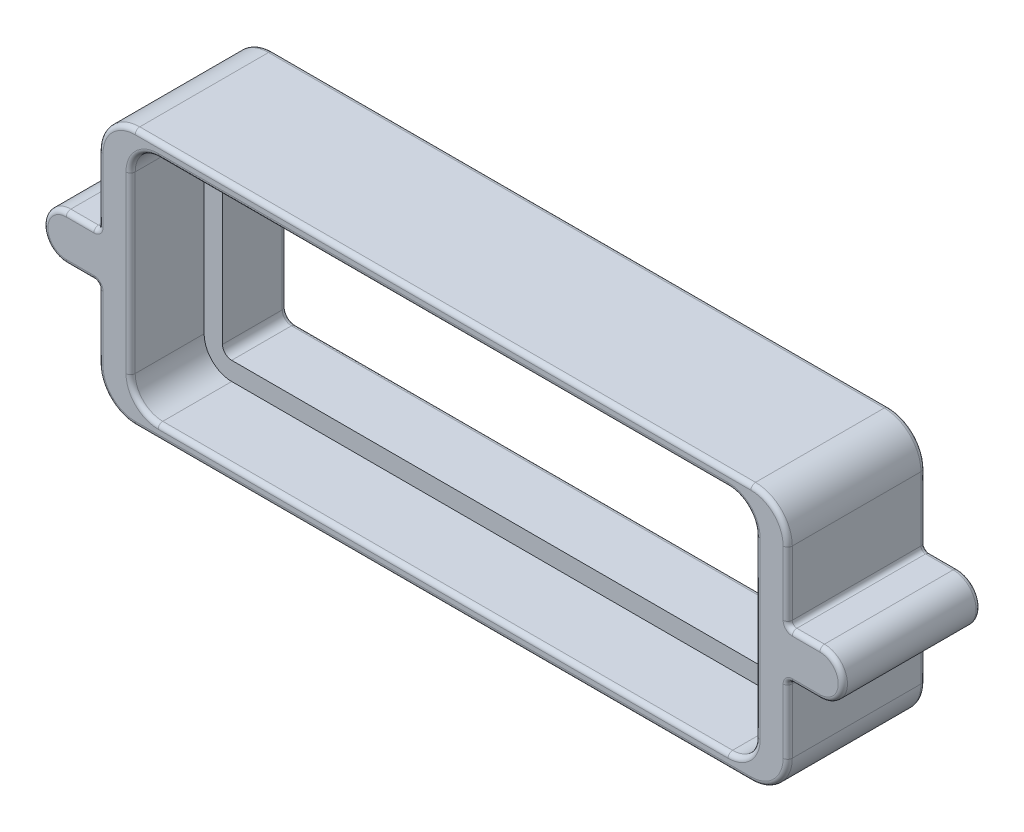
from build123d import *

# Parameters (mm, degrees)
ESQUISSE1_W             = 75
ESQUISSE1_H             = 28
BOSS_EXTRU_1_DEPTH      = 15
CONG_1_R                = 4
BOSS_EXTRU_2_DEPTH      = 15
CONG_2_R                = 0.5
ENL_V_MAT_EXTRU_1_DEPTH = 8
ENL_V_MAT_EXTRU_2_DEPTH = 47.392348507
CONG_3_R                = 0.5


with BuildPart() as part:
    # Esquisse1 → Boss.-Extru.1 (new body)
    with BuildSketch(Plane.XY):
        Rectangle(ESQUISSE1_W, ESQUISSE1_H)
    extrude(amount=BOSS_EXTRU_1_DEPTH)

    # Congé1
    cong_1_edges = [part.edges().sort_by_distance(p)[0] for p in [
        (37.5, -14, 7.5),
        (-37.5, -14, 7.5),
        (-37.5, 14, 7.5),
        (37.5, 14, 7.5),
    ]]
    fillet(cong_1_edges, radius=CONG_1_R)

    # Esquisse2 → Boss.-Extru.2 (add)
    with BuildSketch(Plane.XY.offset(15)):
        with BuildLine():
            Line((-41, 2.5), (41, 2.5))
            ThreePointArc((41, 2.5), (43.5, 0), (41, -2.5))
            Line((41, -2.5), (-41, -2.5))
            ThreePointArc((-41, -2.5), (-43.5, 0), (-41, 2.5))
        make_face()
    extrude(amount=-BOSS_EXTRU_2_DEPTH)

    # Congé2
    cong_2_edges = [part.edges().sort_by_distance(p)[0] for p in [
        (37.5, -2.5, 7.5),
        (-37.5, -2.5, 7.5),
        (37.5, 2.5, 7.5),
        (-37.5, 2.5, 7.5),
    ]]
    fillet(cong_2_edges, radius=CONG_2_R)

    # Esquisse3 → Enlèv. mat.-Extru.1 (cut)
    with BuildSketch(Plane.XY.offset(15)):
        with BuildLine():
            Line((-31, 12.5), (31, 12.5))
            ThreePointArc((31, 12.5), (33.121320344, 11.621320344), (34, 9.5))
            Line((34, 9.5), (34, -9.5))
            ThreePointArc((34, -9.5), (33.121320344, -11.621320344), (31, -12.5))
            Line((31, -12.5), (-31, -12.5))
            ThreePointArc((-31, -12.5), (-33.121320344, -11.621320344), (-34, -9.5))
            Line((-34, -9.5), (-34, 9.5))
            ThreePointArc((-34, 9.5), (-33.121320344, 11.621320344), (-31, 12.5))
        make_face()
    extrude(amount=-ENL_V_MAT_EXTRU_1_DEPTH, mode=Mode.SUBTRACT)

    # Esquisse4 → Enlèv. mat.-Extru.2 (cut, through all)
    with BuildSketch(Plane.XY.offset(7)):
        with BuildLine():
            Line((31, 10.5), (-31, 10.5))
            ThreePointArc((-31, 10.5), (-31.707106781, 10.207106781), (-32, 9.5))
            Line((-32, 9.5), (-32, -9.5))
            ThreePointArc((-32, -9.5), (-31.707106781, -10.207106781), (-31, -10.5))
            Line((-31, -10.5), (31, -10.5))
            ThreePointArc((31, -10.5), (31.707106781, -10.207106781), (32, -9.5))
            Line((32, -9.5), (32, 9.5))
            ThreePointArc((32, 9.5), (31.707106781, 10.207106781), (31, 10.5))
        make_face()
    extrude(amount=-ENL_V_MAT_EXTRU_2_DEPTH, mode=Mode.SUBTRACT)

    # Congé3
    cong_3_edges = [part.edges().sort_by_distance(p)[0] for p in [
        (33.121320344, -11.621320344, 15),
        (34, 0, 15),
        (31.707106781, 10.207106781, 0),
        (32, 0, 0),
        (31.707106781, -10.207106781, 0),
        (0, -10.5, 0),
        (-31.707106781, -10.207106781, 0),
        (-32, 0, 0),
        (-31.707106781, 10.207106781, 0),
        (0, 10.5, 0),
        (37.5, -6.5, 0),
        (37.5, -6.5, 15),
        (0, -14, 0),
        (-37.5, 6.5, 0),
        (0, 14, 0),
        (-36.328427125, -12.828427125, 0),
        (36.328427125, 12.828427125, 0),
        (-36.328427125, 12.828427125, 0),
        (36.328427125, -12.828427125, 0),
        (0, -14, 15),
        (0, 14, 15),
        (-37.5, 6.5, 15),
        (-36.328427125, -12.828427125, 15),
        (36.328427125, 12.828427125, 15),
        (-36.328427125, 12.828427125, 15),
        (36.328427125, -12.828427125, 15),
        (43.5, 0, 15),
        (39.5, 2.5, 15),
        (-43.5, 0, 15),
        (-39.5, -2.5, 15),
        (-39.5, -2.5, 0),
        (39.5, 2.5, 0),
        (43.5, 0, 0),
        (-43.5, 0, 0),
        (37.5, 6.5, 15),
        (37.5, 6.5, 0),
        (39.5, -2.5, 0),
        (39.5, -2.5, 15),
        (-39.5, 2.5, 0),
        (-39.5, 2.5, 15),
        (-37.5, -6.5, 15),
        (-37.5, -6.5, 0),
        (37.646446609, 2.646446609, 0),
        (37.646446609, 2.646446609, 15),
        (37.646446609, -2.646446609, 15),
        (37.646446609, -2.646446609, 0),
        (-37.646446609, 2.646446609, 15),
        (-37.646446609, 2.646446609, 0),
        (-37.646446609, -2.646446609, 0),
        (-37.646446609, -2.646446609, 15),
        (33.121320344, 11.621320344, 15),
        (0, 12.5, 15),
        (-33.121320344, 11.621320344, 15),
        (-34, 0, 15),
        (-33.121320344, -11.621320344, 15),
        (0, -12.5, 15),
    ]]
    fillet(cong_3_edges, radius=CONG_3_R)


solid = part.part
